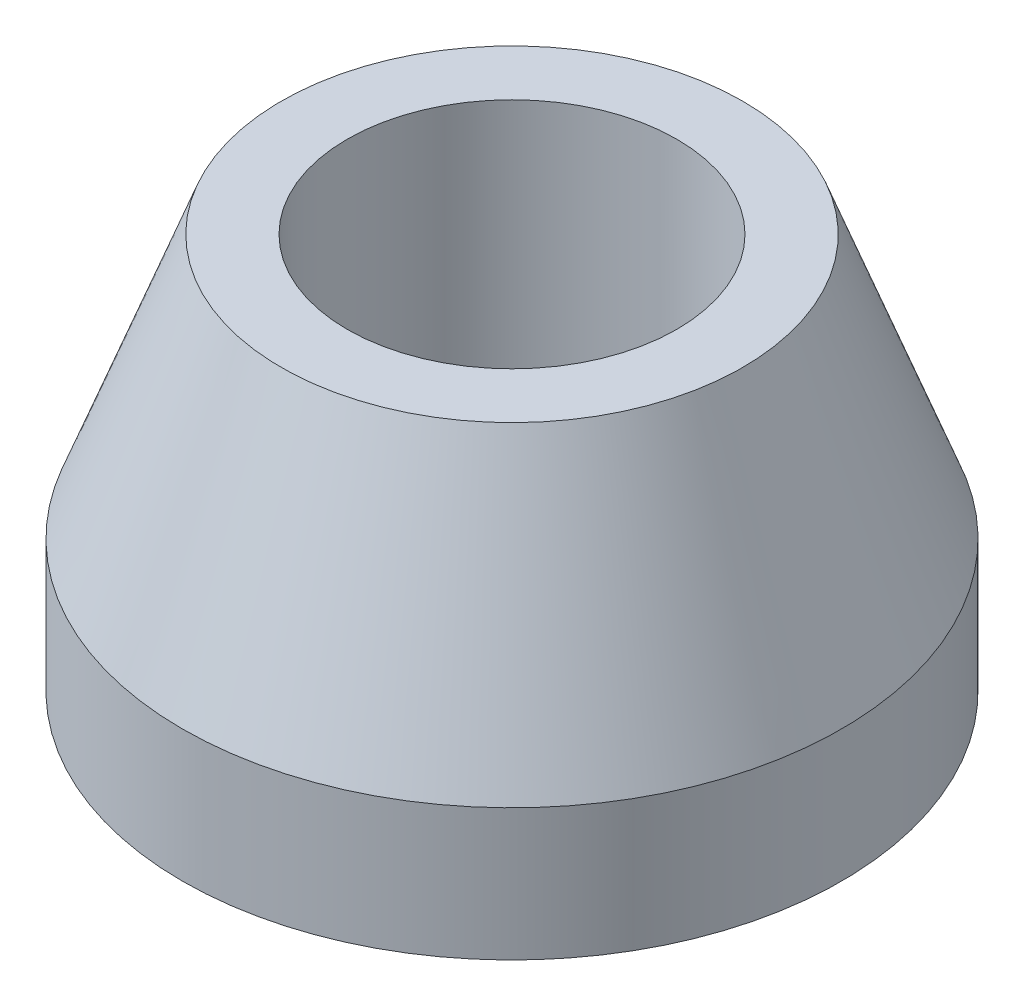
from build123d import *

# Parameters (mm, degrees)
SKETCH_2_R          = 5
CUT_EXTRUDE_1_DEPTH = 93.736184955


with BuildPart() as part:
    # 草圖1 → 旋轉1 (revolve)
    with BuildSketch(Plane.XY, mode=Mode.PRIVATE) as revolve_1_sk:
        Polygon((25, 0), (50, 0), (50, 20), (35, 60), (25, 60), align=None)
    revolve(revolve_1_sk.sketch.rotate(Axis((0, 0, 0), (0, 1, 0)), 90), axis=Axis((0, 0, 0), (0, 1, 0)))

    # 草圖2 → 除料-伸長1 (cut, through all)
    with BuildSketch(Plane.XY):
        with Locations(Location((0, 10, 0), (0, 0, 270))):
            Circle(SKETCH_2_R)
    extrude(amount=-CUT_EXTRUDE_1_DEPTH, mode=Mode.SUBTRACT)


solid = part.part
